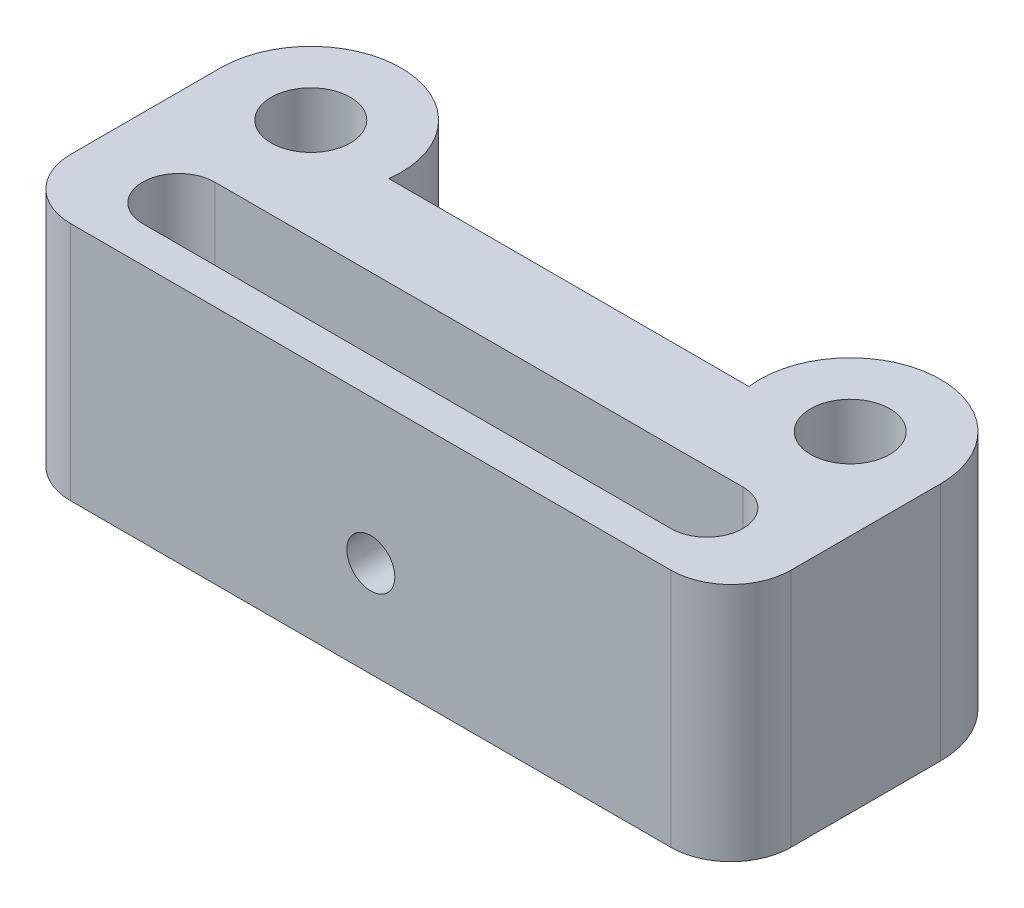
from build123d import *

# Parameters (mm, degrees)
ESQUISSE1_R             = 3
BOSS_EXTRU_1_DEPTH      = 20
ESQUISSE2_R             = 2
ENL_V_MAT_EXTRU_1_DEPTH = 44.874821937
CONG_1_R                = 5
D_GAGEMENT_M61_D        = 6.6


with BuildPart() as part:
    # Esquisse1 → Boss.-Extru.1 (new body)
    with BuildSketch(Plane(origin=(0, 0, 0), x_dir=(1, 0, 0), z_dir=(0, 1, 0))):
        with BuildLine():
            Line((30, 0), (-30, 0))
            Line((-30, 0), (-30, 17.468719423))
            ThreePointArc((-30, 17.468719423), (-21.983350692, 24.984343437), (-15, 16.5))
            Line((-15, 16.5), (15, 16.5))
            ThreePointArc((15, 16.5), (21.983350692, 24.984343437), (30, 17.468719423))
            Line((30, 17.468719423), (30, 0))
        make_face()
        with Locations(Location((-22.468719423, 17.468719423, 0), (0, 0, 270))):
            Circle(ESQUISSE1_R, mode=Mode.SUBTRACT)
        with Locations(Location((22.468719423, 17.468719423, 0), (0, 0, 90))):
            Circle(ESQUISSE1_R, mode=Mode.SUBTRACT)
        with BuildLine():
            Line((22, 3), (-22, 3))
            ThreePointArc((-22, 3), (-25, 6), (-22, 9))
            Line((-22, 9), (22, 9))
            ThreePointArc((22, 9), (25, 6), (22, 3))
        make_face(mode=Mode.SUBTRACT)
    extrude(amount=BOSS_EXTRU_1_DEPTH)

    # Esquisse2 → Enlèv. mat.-Extru.1 (cut, through all)
    with BuildSketch(Plane.XY):
        with Locations((0, 8)):
            Circle(ESQUISSE2_R)
    extrude(amount=-ENL_V_MAT_EXTRU_1_DEPTH, mode=Mode.SUBTRACT)

    # Congé1
    cong_1_edges = [part.edges().sort_by_distance(p)[0] for p in [
        (30, 10, 0),
        (-30, 10, 0),
    ]]
    fillet(cong_1_edges, radius=CONG_1_R)

    # Dégagement M61 (through all)
    with Locations(Plane(origin=(0, 20, 0), x_dir=(1, 0, 0), z_dir=(0, 1, 0))):
        with Locations((-22.468719423, 17.468719423), (22.468719423, 17.468719423)):
            Hole(D_GAGEMENT_M61_D / 2)


solid = part.part
